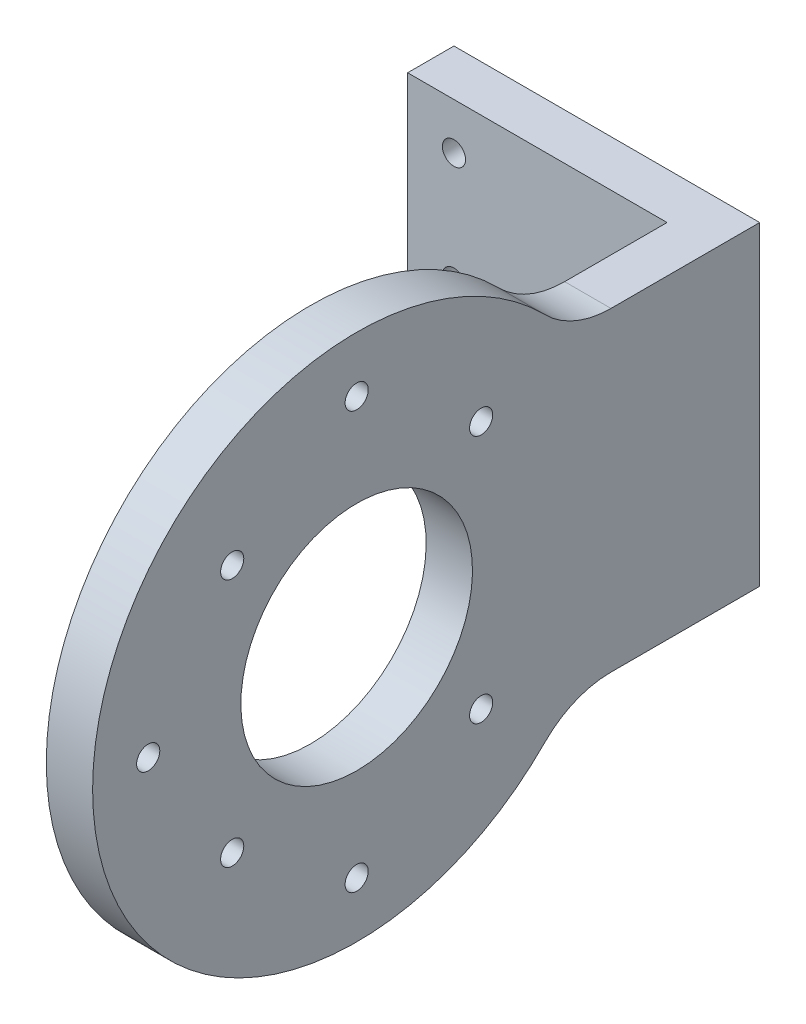
from build123d import *

# Parameters (mm, degrees)
EXTRUDE_1_DEPTH          = 5
SKETCH_2_W               = 67
SKETCH_2_H               = 34
EXTRUDE_2_DEPTH          = 5
SKETCH_4_W               = 57
SKETCH_4_H               = 57
EXTRUDE_3_DEPTH          = 5
CUT_EXTRUDE_1_DEPTH      = 5
FILLET_1_R               = 10
FILLET_2_R               = 10
SKETCH_6_R               = 1.25
SKETCH_6_R_2             = 12.5
CUT_EXTRUDE_2_DEPTH      = 5
PATTERN_CIRCULAR_1_COUNT = 4
SKETCH_7_R               = 1.25
CUT_EXTRUDE_3_DEPTH      = 5
SKETCH_8_R               = 1.25
CUT_EXTRUDE_5_DEPTH      = 10
PATTERN_CIRCULAR_2_COUNT = 3
PATTERN_CIRCULAR_2_ANGLE = 180


with BuildPart() as part:
    # 草图1 → 凸台-拉伸1 (new body)
    with BuildSketch(Plane.XY):
        Polygon((23, 17), (28, 17), (28, -17), (23, -17), (-5, -17), (-5, 17), align=None)
    extrude(amount=EXTRUDE_1_DEPTH)

    # 草图2 → 凸台-拉伸2 (add)
    with BuildSketch(Plane(origin=(28, 0, 0), x_dir=(0, 0, -1), z_dir=(1, 0, 0))):
        with Locations((-38.5, 0)):
            Rectangle(SKETCH_2_W, SKETCH_2_H)
    extrude(amount=-EXTRUDE_2_DEPTH)

    # 草图4 → 凸台-拉伸3 (add)
    with BuildSketch(Plane.ZY.offset(-23)):
        with Locations((43.5, 0)):
            Rectangle(SKETCH_4_W, SKETCH_4_H)
    extrude(amount=-EXTRUDE_3_DEPTH)

    # 草图5 → 切除-拉伸1 (cut)
    with BuildSketch(Plane.ZY.offset(-23)):
        with BuildLine():
            Line((15, 28.5), (15, 17))
            Line((15, 17), (20.625341533, 17))
            ThreePointArc((20.625341533, 17), (30.698632886, 25.463208753), (43.5, 28.5))
            Line((43.5, 28.5), (15, 28.5))
        make_face()
        with BuildLine():
            ThreePointArc((43.500000073, -28.5), (30.698632918, -25.463208769), (20.625341533, -17))
            Line((20.625341533, -17), (15, -17))
            Line((15, -17), (15, -28.5))
            Line((15, -28.5), (43.500000073, -28.5))
        make_face()
        with BuildLine():
            ThreePointArc((72, 0), (63.65254329, -20.152543238), (43.500000073, -28.5))
            Line((43.500000073, -28.5), (72, -28.5))
            Line((72, -28.5), (72, 0))
        make_face()
        with BuildLine():
            Line((72, 28.5), (43.5, 28.5))
            ThreePointArc((43.5, 28.5), (63.652543264, 20.152543264), (72, 0))
            Line((72, 0), (72, 28.5))
        make_face()
    extrude(amount=-CUT_EXTRUDE_1_DEPTH, mode=Mode.SUBTRACT)

    # 圆角1
    fillet_1_edges = [part.edges().sort_by_distance(p)[0] for p in [
        (25.5, 17, 20.625341533),
    ]]
    fillet(fillet_1_edges, radius=FILLET_1_R)

    # 圆角2
    fillet_2_edges = [part.edges().sort_by_distance(p)[0] for p in [
        (25.5, -17, 20.625341533),
    ]]
    fillet(fillet_2_edges, radius=FILLET_2_R)

    # 草图6 → 切除-拉伸2 (cut)
    with BuildSketch(Plane.ZY.offset(-23)):
        with Locations(Location((56.935028843, 13.435028843, 0), (0, 0, 270))):
            Circle(SKETCH_6_R)
        with Locations(Location((43.5, 0, 0), (0, 0, 270))):
            Circle(SKETCH_6_R_2)
    cut_extrude_2 = extrude(amount=-CUT_EXTRUDE_2_DEPTH, mode=Mode.SUBTRACT)

    # 阵列(圆周)1: 切除-拉伸2 ×4 about axis
    pattern_circular_1_axis = Axis((0, 0, 43.5), (1, 0, 0))
    for i in range(1, PATTERN_CIRCULAR_1_COUNT):
        add(cut_extrude_2.rotate(pattern_circular_1_axis, i * 360 / PATTERN_CIRCULAR_1_COUNT), mode=Mode.SUBTRACT)

    # 草图7 → 切除-拉伸3 (cut)
    with BuildSketch(Plane.XY.offset(5)):
        Circle(SKETCH_7_R)
        with Locations((0, 12)):
            Circle(SKETCH_7_R)
        with Locations(Location((0, -12, 0), (0, 0, 180))):
            Circle(SKETCH_7_R)
    extrude(amount=-CUT_EXTRUDE_3_DEPTH, mode=Mode.SUBTRACT)

    # 草图8 → 切除-拉伸5 (cut)
    with BuildSketch(Plane(origin=(28, 0, 0), x_dir=(0, 0, -1), z_dir=(1, 0, 0))):
        with Locations(Location((-43.5, 22.5, 0), (0, 0, 90))):
            Circle(SKETCH_8_R)
    cut_extrude_5 = extrude(amount=-CUT_EXTRUDE_5_DEPTH, mode=Mode.SUBTRACT)

    # 阵列(圆周)2: 切除-拉伸5 ×3 about axis
    pattern_circular_2_axis = Axis((0, 0, 43.5), (1, 0, 0))
    for i in range(1, PATTERN_CIRCULAR_2_COUNT):
        add(cut_extrude_5.rotate(pattern_circular_2_axis, i * PATTERN_CIRCULAR_2_ANGLE / (PATTERN_CIRCULAR_2_COUNT - 1)), mode=Mode.SUBTRACT)


solid = part.part
